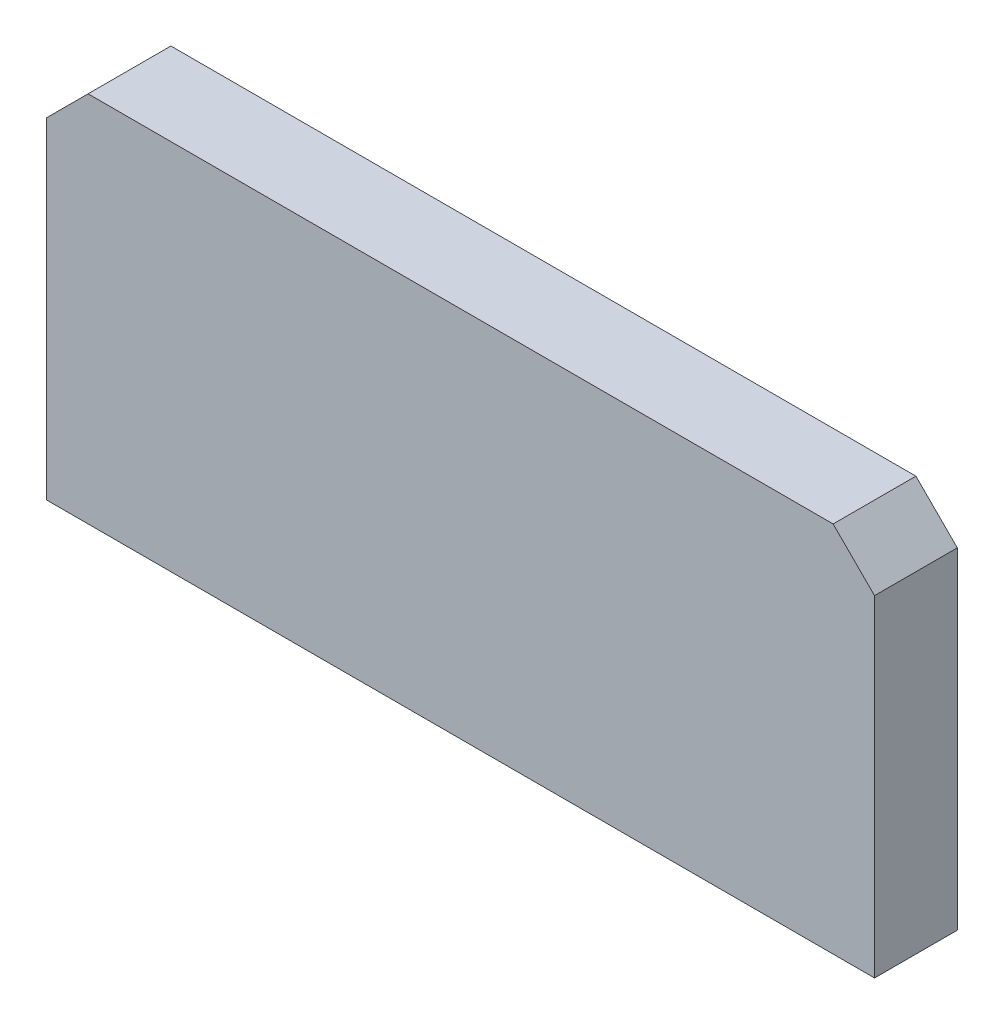
from build123d import *

# Parameters (mm, degrees)
EXTRUDE_1_DEPTH = 10


with BuildPart() as part:
    # 草图1 → 凸台-拉伸1 (new body)
    with BuildSketch(Plane(origin=(0, 0, 0), x_dir=(-1, 0, 0), z_dir=(0, 0, -1))):
        Polygon((50, -20), (50, 20), (45, 25), (-45, 25), (-50, 20), (-50, -20), align=None)
    extrude(amount=-EXTRUDE_1_DEPTH)


solid = part.part
